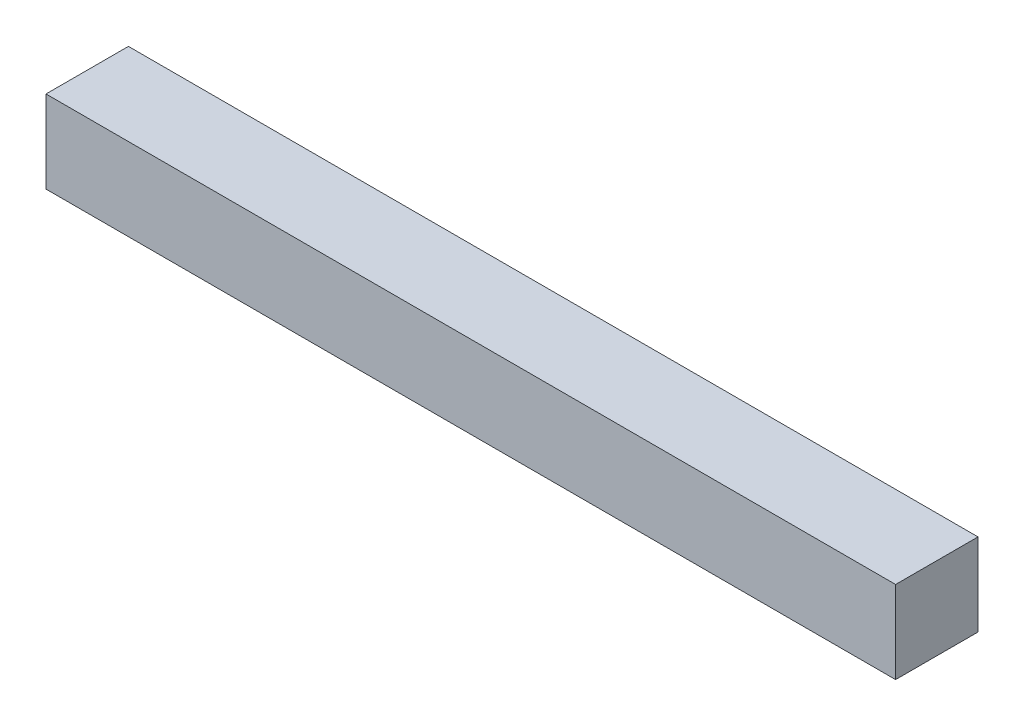
from build123d import *

# Parameters (mm, degrees)
SKETCH_1_W      = 50
SKETCH_1_H      = 4.85
EXTRUDE_1_DEPTH = 4.85


with BuildPart() as part:
    # 草图1 → 凸台-拉伸1 (new body)
    with BuildSketch(Plane.XY):
        with Locations((11.459302289, 3.703133705)):
            Rectangle(SKETCH_1_W, SKETCH_1_H)
    extrude(amount=EXTRUDE_1_DEPTH)


solid = part.part
